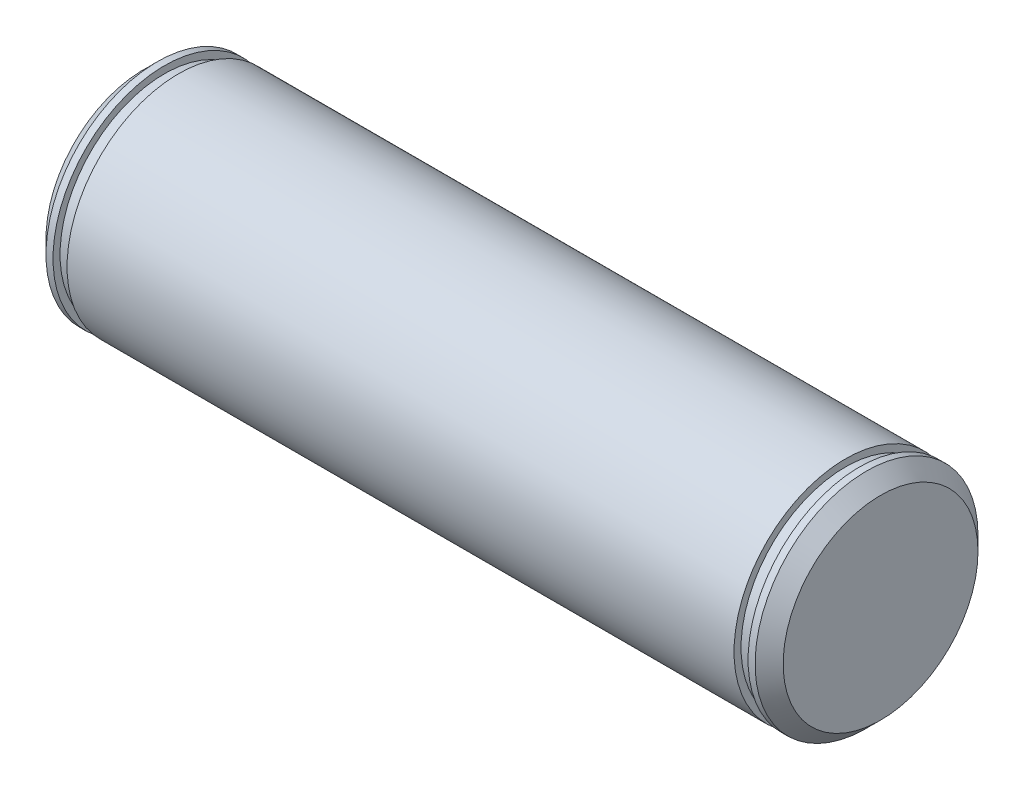
from build123d import *

# Parameters (mm, degrees)
SKETCH1_R           = 15.875
BOSS_EXTRUDE1_DEPTH = 52.5
CHAMFER1_SIZE       = 2
SKETCH2_R           = 15.875
SKETCH2_R_2         = 14.875
CUT_EXTRUDE1_DEPTH  = 2


with BuildPart() as part:
    # Sketch1 → Boss-Extrude1 (new, symmetric)
    with BuildSketch(Plane(origin=(0, 0, 0), x_dir=(0, 0, -1), z_dir=(1, 0, 0))):
        Circle(SKETCH1_R)
    extrude(amount=BOSS_EXTRUDE1_DEPTH, both=True)

    # Chamfer1
    chamfer1_edges = [part.edges().sort_by_distance(p)[0] for p in [
        (-52.5, 0, 15.875),
        (52.5, 0, 15.875),
    ]]
    chamfer(chamfer1_edges, length=CHAMFER1_SIZE)

    # Sketch2 → Cut-Extrude1 (cut)
    with BuildSketch(Plane(origin=(-47.5, 0, 0), x_dir=(0, 0, -1), z_dir=(1, 0, 0))):
        Circle(SKETCH2_R)
        Circle(SKETCH2_R_2, mode=Mode.SUBTRACT)
    cut_extrude1 = extrude(amount=-CUT_EXTRUDE1_DEPTH, mode=Mode.SUBTRACT)

    # Mirror1: Cut-Extrude1 across plane
    add(cut_extrude1.mirror(Plane(origin=(0, 0, 0), x_dir=(0, 0, 1), z_dir=(1, 0, 0))), mode=Mode.SUBTRACT)


solid = part.part
